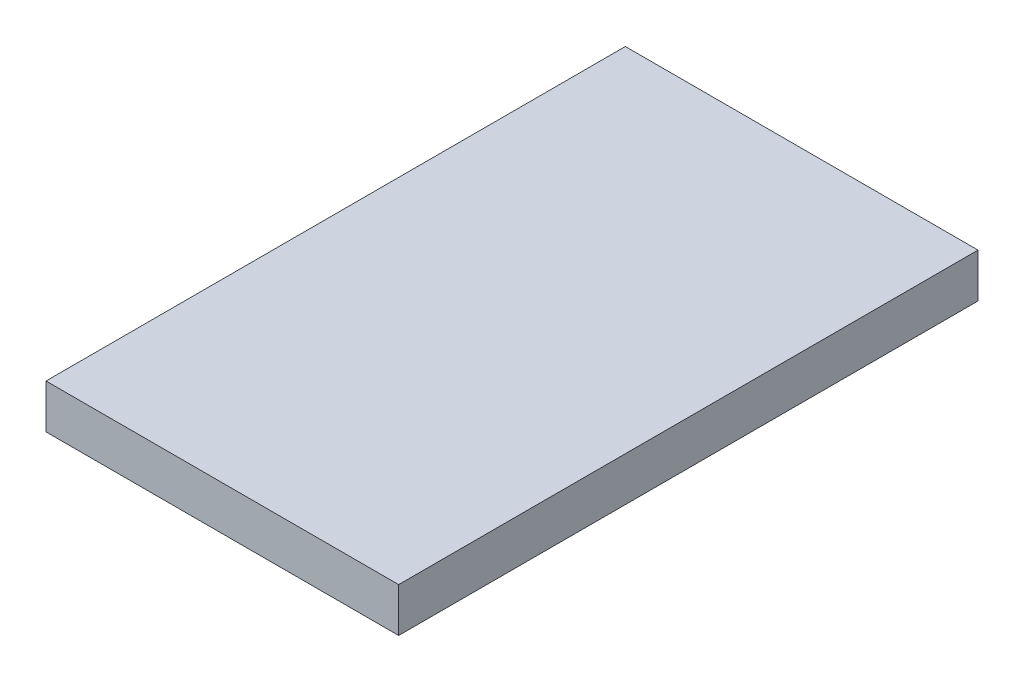
from build123d import *

# Parameters (mm, degrees)
SKETCH_1_W      = 56
SKETCH_1_H      = 7
EXTRUDE_1_DEPTH = 92


with BuildPart() as part:
    # 草图1 → 凸台-拉伸1 (new body)
    with BuildSketch(Plane.XY):
        Rectangle(SKETCH_1_W, SKETCH_1_H)
    extrude(amount=EXTRUDE_1_DEPTH)


solid = part.part
